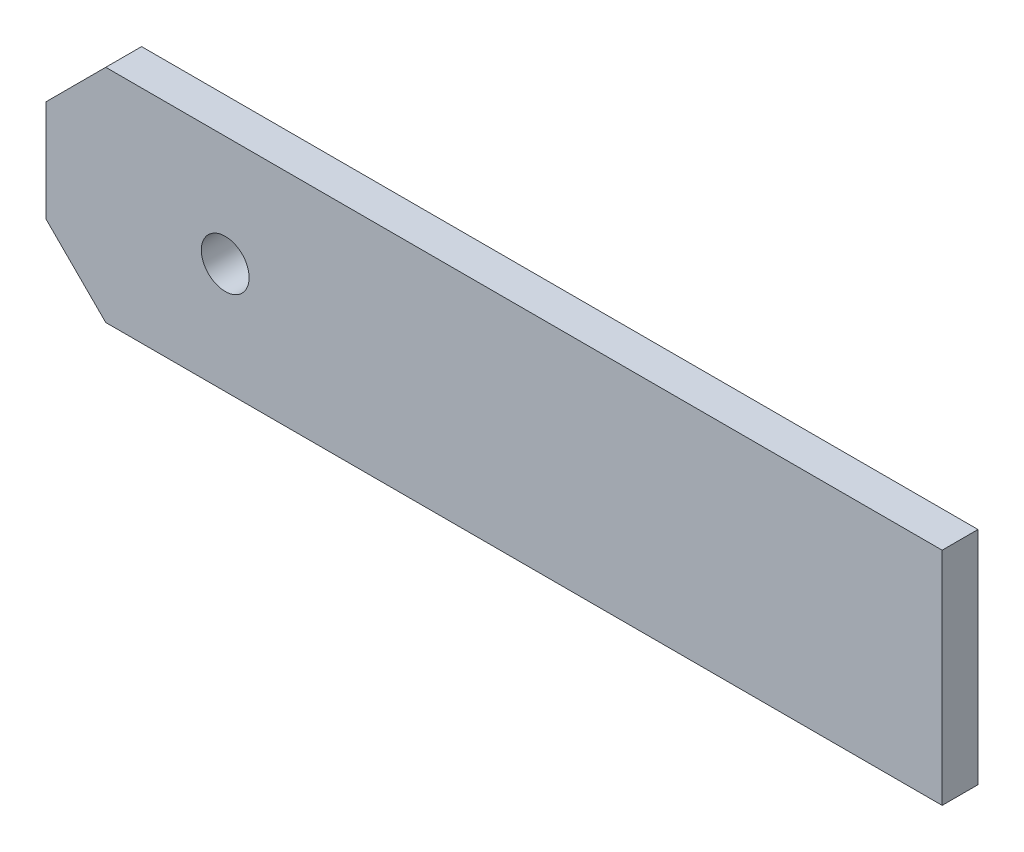
from build123d import *

# Parameters (mm, degrees)
SKETCH1_R           = 4
BOSS_EXTRUDE1_DEPTH = 6


with BuildPart() as part:
    # Sketch1 → Boss-Extrude1 (new body)
    with BuildSketch(Plane.XY):
        Polygon((-997.415730337, 66.134831461), (-857.415730337, 66.134831461), (-857.415730337, 29.134831461), (-997.415730337, 29.134831461), (-1007.415730337, 39.134831461), (-1007.415730337, 56.134831461), align=None)
        with Locations((-977.415730337, 47.634831461)):
            Circle(SKETCH1_R, mode=Mode.SUBTRACT)
    extrude(amount=BOSS_EXTRUDE1_DEPTH)


solid = part.part
